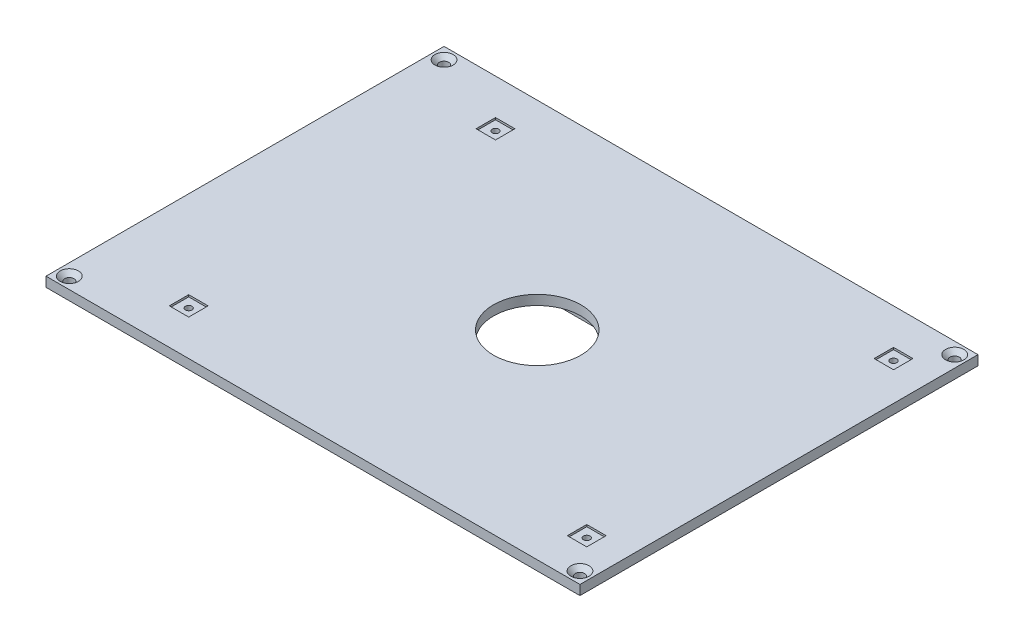
from build123d import *

# Parameters (mm, degrees)
ESQUISSE1_W                                    = 275
ESQUISSE1_H                                    = 205
BOSS_EXTRU_1_DEPTH                             = 5
FRAISAGE_POUR_VIS_T_TE_FRAIS_E_M41_D           = 4.8
FRAISAGE_POUR_VIS_T_TE_FRAIS_E_M41_CSINK_D     = 9.4
FRAISAGE_POUR_VIS_T_TE_FRAIS_E_M41_CSINK_ANGLE = 90
ESQUISSE5_W                                    = 10
ESQUISSE5_H                                    = 10
ENL_V_MAT_EXTRU_1_DEPTH                        = 1
ENL_V_MAT_EXTRU_2_DEPTH                        = 172.573599368
ENL_V_MAT_EXTRU_2_DEPTH_BACK                   = 172.573599368
ESQUISSE9_R                                    = 22.5
D_GAGEMENT_M32_D                               = 3.4
D_GAGEMENT_M32_DEPTH                           = 12
D_GAGEMENT_M32_TIP                             = 1.021463052
ESQUISSE16_W                                   = 100
ESQUISSE16_H                                   = 5
BOSS_EXTRU_2_DEPTH                             = 7
ESQUISSE18_W                                   = 100
ESQUISSE18_H                                   = 2.5
ENL_V_MAT_EXTRU_3_DEPTH                        = 1.7
ESQUISSE17_W                                   = 100
ESQUISSE17_H                                   = 2.5
ENL_V_MAT_EXTRU_4_DEPTH                        = 1.7
BOSS_EXTRU_4_DEPTH                             = 7
ESQUISSE21_W                                   = 20.5
ESQUISSE21_H                                   = 6.5
ENL_V_MAT_EXTRU_5_DEPTH                        = 13


with BuildPart() as part:
    # Esquisse1 → Boss.-Extru.1 (new body)
    with BuildSketch(Plane(origin=(0, 0, 0), x_dir=(1, 0, 0), z_dir=(0, 1, 0))):
        Rectangle(ESQUISSE1_W, ESQUISSE1_H)
    extrude(amount=BOSS_EXTRU_1_DEPTH)

    # Fraisage pour vis à tête fraisée M41 (through all)
    with Locations(Plane(origin=(0, 5, 0), x_dir=(1, 0, 0), z_dir=(0, 1, 0))):
        with Locations((-131.5, 96.5), (-131.5, -96.5), (131.5, -96.5), (131.5, 96.5)):
            CounterSinkHole(FRAISAGE_POUR_VIS_T_TE_FRAIS_E_M41_D / 2, FRAISAGE_POUR_VIS_T_TE_FRAIS_E_M41_CSINK_D / 2, counter_sink_angle=FRAISAGE_POUR_VIS_T_TE_FRAIS_E_M41_CSINK_ANGLE)

    # Esquisse5 → Enlèv. mat.-Extru.1 (cut)
    with BuildSketch(Plane(origin=(0, 5, 0), x_dir=(1, 0, 0), z_dir=(0, 1, 0))):
        with Locations((-87.5, 79)):
            Rectangle(ESQUISSE5_W, ESQUISSE5_H)
        with Locations((117.5, 79)):
            Rectangle(ESQUISSE5_W, ESQUISSE5_H)
        with Locations((117.5, -79)):
            Rectangle(ESQUISSE5_W, ESQUISSE5_H)
        with Locations((-87.5, -79)):
            Rectangle(ESQUISSE5_W, ESQUISSE5_H)
    extrude(amount=-ENL_V_MAT_EXTRU_1_DEPTH, mode=Mode.SUBTRACT)

    # Esquisse9 → Enlèv. mat.-Extru.2 (cut, two sides: drawn at the far end of the back side and taken through both)
    with BuildSketch(Plane(origin=(0, 5, 0), x_dir=(1, 0, 0), z_dir=(0, 1, 0)).offset(-ENL_V_MAT_EXTRU_2_DEPTH_BACK)):
        with Locations(Location((13, 0, 0), (0, 0, 270))):
            Circle(ESQUISSE9_R)
    extrude(amount=ENL_V_MAT_EXTRU_2_DEPTH + ENL_V_MAT_EXTRU_2_DEPTH_BACK, mode=Mode.SUBTRACT)

    # Dégagement M32
    with Locations(Plane(origin=(0, 4, 0), x_dir=(1, 0, 0), z_dir=(0, 1, 0))):
        with Locations((-87.5, -79), (-87.5, 79), (117.5, 79), (117.5, -79)):
            Hole(D_GAGEMENT_M32_D / 2, depth=D_GAGEMENT_M32_DEPTH)
            with Locations((0, 0, -(D_GAGEMENT_M32_DEPTH + D_GAGEMENT_M32_TIP / 2))):  # 118° drill point
                Cone(0, D_GAGEMENT_M32_D / 2, D_GAGEMENT_M32_TIP, mode=Mode.SUBTRACT)

    # Esquisse16 → Boss.-Extru.2 (add)
    with BuildSketch(Plane.XZ):
        with Locations((-15, 30.5)):
            Rectangle(ESQUISSE16_W, ESQUISSE16_H)
        with Locations((-15, -30.5)):
            Rectangle(ESQUISSE16_W, ESQUISSE16_H)
    extrude(amount=BOSS_EXTRU_2_DEPTH)

    # Esquisse18 → Enlèv. mat.-Extru.3 (cut)
    with BuildSketch(Plane(origin=(0, 0, 28), x_dir=(-1, 0, 0), z_dir=(0, 0, -1))):
        with Locations((15, -1.25)):
            Rectangle(ESQUISSE18_W, ESQUISSE18_H)
    extrude(amount=-ENL_V_MAT_EXTRU_3_DEPTH, mode=Mode.SUBTRACT)

    # Esquisse17 → Enlèv. mat.-Extru.4 (cut)
    with BuildSketch(Plane.XY.offset(-28)):
        with Locations((-15, -1.25)):
            Rectangle(ESQUISSE17_W, ESQUISSE17_H)
    extrude(amount=-ENL_V_MAT_EXTRU_4_DEPTH, mode=Mode.SUBTRACT)

    # Esquisse19 → Boss.-Extru.4 (add)
    with BuildSketch(Plane(origin=(0, 0, 0), x_dir=(-1, 0, 0), z_dir=(0, -1, 0))):
        Polygon((-35, -33), (-40, -33), (-45, -33), (-45, -3.794590368), (-40, -3.794590368), (-40, 33), (-35, 33), (-35, 3.79695048), (-35.5, 0), (-35, -3.794590368), align=None)
    extrude(amount=BOSS_EXTRU_4_DEPTH)

    # Esquisse21 → Enlèv. mat.-Extru.5 (cut)
    with BuildSketch(Plane.ZY.offset(-35)):
        with Locations((15.149590368, -3.5)):
            Rectangle(ESQUISSE21_W, ESQUISSE21_H)
    extrude(amount=-ENL_V_MAT_EXTRU_5_DEPTH, mode=Mode.SUBTRACT)


solid = part.part
